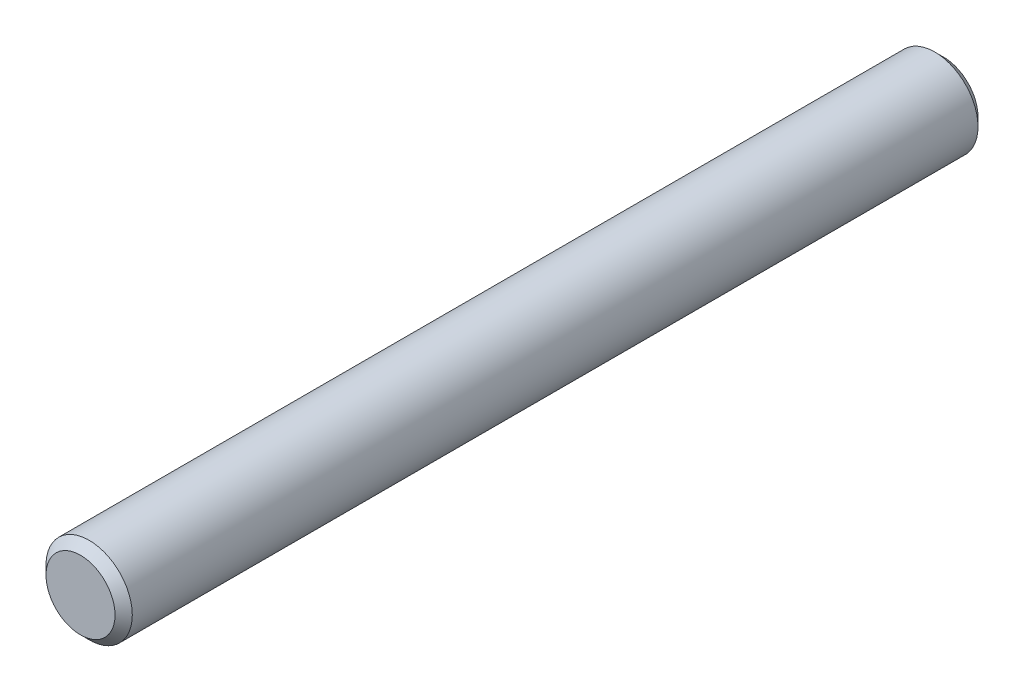
from build123d import *

# Parameters (mm, degrees)
SKETCH1_R          = 5
CORPO_10_100_DEPTH = 100
CHANFRO_1_45_SIZE  = 1


with BuildPart() as part:
    # Sketch1 → Corpo Ø10×100 (new body)
    with BuildSketch(Plane.XY):
        Circle(SKETCH1_R)
    extrude(amount=CORPO_10_100_DEPTH)

    # Chanfro 1×45°
    chanfro_1_45_edges = [part.edges().sort_by_distance(p)[0] for p in [
        (-5, 0, 0),
        (-5, 0, 100),
    ]]
    chamfer(chanfro_1_45_edges, length=CHANFRO_1_45_SIZE)


solid = part.part
